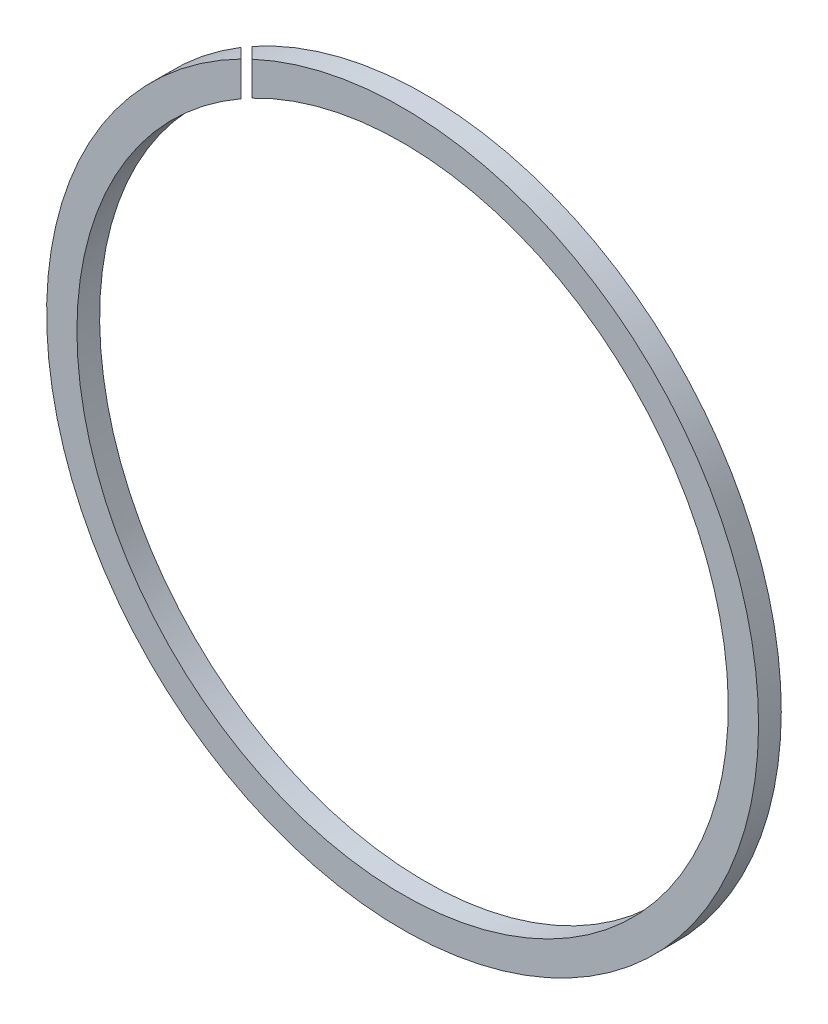
from build123d import *

# Parameters (mm, degrees)
SKETCH1_R           = 47
SKETCH1_R_2         = 43
BOSS_EXTRUDE1_DEPTH = 1.5
CUT_EXTRUDE1_DEPTH  = 100


with BuildPart() as part:
    # Sketch1 → Boss-Extrude1 (new, symmetric)
    with BuildSketch(Plane(origin=(0, 0, 0), x_dir=(0, 1, 0), z_dir=(0, 0, 1))):
        with Locations(Location((0, 0, 0), (0, 0, 270))):
            Circle(SKETCH1_R)
        with Locations(Location((0, 0, 0), (0, 0, 270))):
            Circle(SKETCH1_R_2, mode=Mode.SUBTRACT)
    extrude(amount=BOSS_EXTRUDE1_DEPTH, both=True)

    # Sketch4 → Cut-Extrude1 (cut)
    with BuildSketch(Plane(origin=(0, 0, 0), x_dir=(-1, 0, 0), z_dir=(0, 1, 0))):
        Polygon((19.908984976, 1.5), (22.908984976, -1.5), (24.323198539, -1.5), (21.323198539, 1.5), align=None)
    extrude(amount=CUT_EXTRUDE1_DEPTH, mode=Mode.SUBTRACT)


solid = part.part
